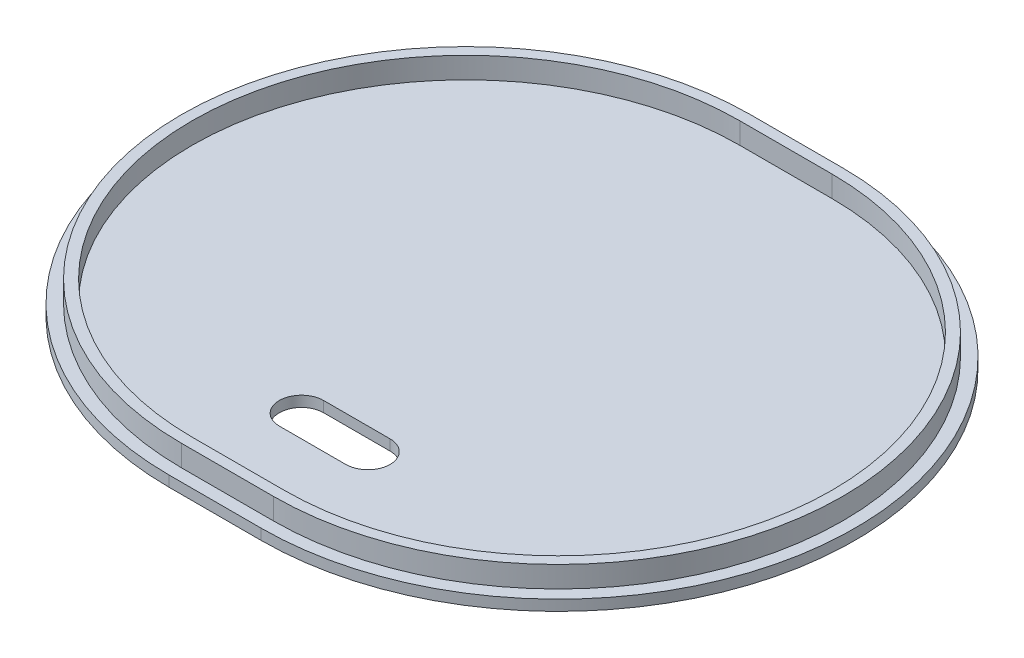
from build123d import *

# Parameters (mm, degrees)
BOSS_EXTRUDE1_DEPTH = 2.4
BOSS_EXTRUDE2_DEPTH = 4.8
CUT_EXTRUDE1_DEPTH  = 103.48316935


with BuildPart() as part:
    # Sketch1 → Boss-Extrude1 (new body)
    with BuildSketch(Plane(origin=(0, 0, 0), x_dir=(1, 0, 0), z_dir=(0, 1, 0))):
        with BuildLine():
            Line((-10.4, 67), (10.4, 67))
            ThreePointArc((10.4, 67), (77.4, 0), (10.4, -67))
            Line((10.4, -67), (-10.4, -67))
            ThreePointArc((-10.4, -67), (-77.4, 0), (-10.4, 67))
        make_face()
    extrude(amount=BOSS_EXTRUDE1_DEPTH)

    # Sketch2 → Boss-Extrude2 (add)
    with BuildSketch(Plane(origin=(0, 2.4, 0), x_dir=(1, 0, 0), z_dir=(0, 1, 0))):
        with BuildLine():
            Line((-10.4, 64.2), (10.4, 64.2))
            ThreePointArc((10.4, 64.2), (74.6, 0), (10.4, -64.2))
            Line((10.4, -64.2), (-10.4, -64.2))
            ThreePointArc((-10.4, -64.2), (-74.6, 0), (-10.4, 64.2))
        make_face()
        with BuildLine():
            Line((-10.4, 61.8), (10.4, 61.8))
            ThreePointArc((10.4, 61.8), (72.2, 0), (10.4, -61.8))
            Line((10.4, -61.8), (-10.4, -61.8))
            ThreePointArc((-10.4, -61.8), (-72.2, 0), (-10.4, 61.8))
        make_face(mode=Mode.SUBTRACT)
    extrude(amount=BOSS_EXTRUDE2_DEPTH)

    # Sketch3 → Cut-Extrude1 (cut, through all)
    with BuildSketch(Plane(origin=(0, 2.4, 0), x_dir=(1, 0, 0), z_dir=(0, 1, 0))):
        with BuildLine():
            Line((-7.5, -35), (7.5, -35))
            ThreePointArc((7.5, -35), (12.5, -40), (7.5, -45))
            Line((7.5, -45), (-7.5, -45))
            ThreePointArc((-7.5, -45), (-12.5, -40), (-7.5, -35))
        make_face()
    extrude(amount=-CUT_EXTRUDE1_DEPTH, mode=Mode.SUBTRACT)


solid = part.part
